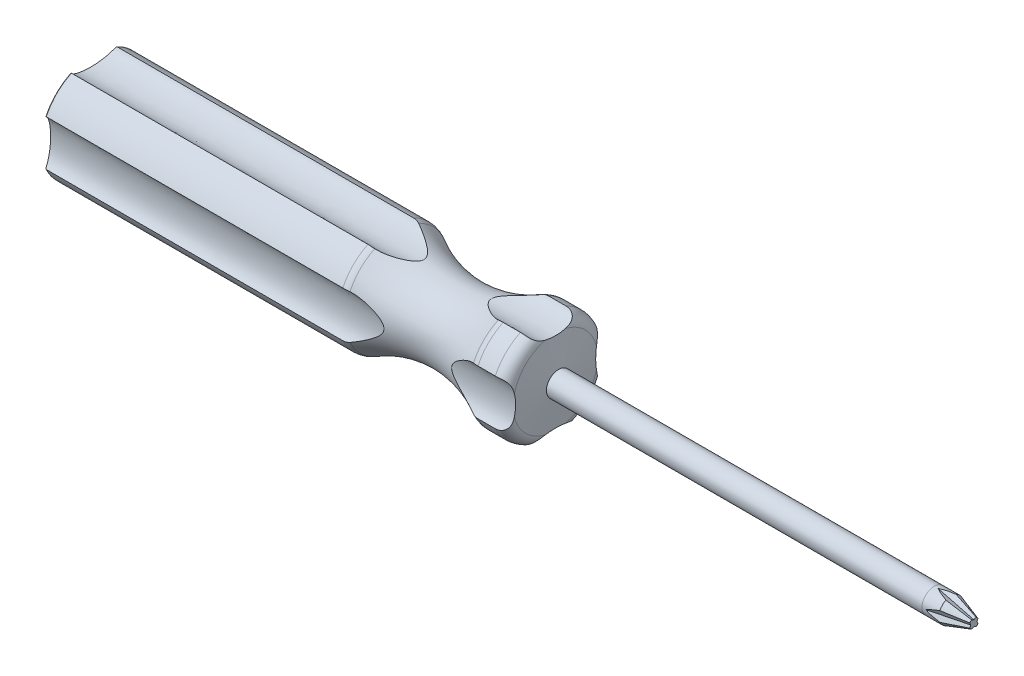
from build123d import *

# Parameters (mm, degrees)
SKETCH5_R                    = 0.53922581
CUT_EXTRUDE3_DEPTH           = 24
CUT_EXTRUDE1_DEPTH           = 3
CUT_EXTRUDE1_TAPER           = 23
CUT_EXTRUDE1_OTHER_WAY_DEPTH = 3
CUT_EXTRUDE1_OTHER_WAY_DRAFT = 23
CIRPATTERN1_COUNT            = 4
CIRPATTERN1_COPY_1_DEPTH     = 3
CIRPATTERN1_COPY_1_DRAFT     = 23
CIRPATTERN1_COPY_2_DEPTH     = 3
CIRPATTERN1_COPY_2_DRAFT     = 23
CIRPATTERN1_COPY_3_DEPTH     = 3
CIRPATTERN1_COPY_3_DRAFT     = 23
CIRPATTERN1_COPY_4_DEPTH     = 3
CIRPATTERN1_COPY_4_DRAFT     = 23
CIRPATTERN1_COPY_5_DEPTH     = 3
CIRPATTERN1_COPY_5_DRAFT     = 23
CIRPATTERN1_COPY_6_DEPTH     = 3
CIRPATTERN1_COPY_6_DRAFT     = 23
FILLET1_R                    = 4
SKETCH4_RX                   = 7.657958065
SKETCH4_RY                   = 3.350356654
CUT_EXTRUDE2_DEPTH           = 175
CIRPATTERN2_COUNT            = 4


with BuildPart() as part:
    # Sketch1 → Revolve1 (revolve)
    with BuildSketch(Plane.XY):
        Polygon((0, 0), (113.715967703, 0), (121.186821436, 0), (121.186821436, 1.520939997), (113.715967703, 4), (0, 4), (-66.928577077, 4), (-66.928577077, 0), align=None)
    revolve(axis=Axis((0, 0, 0), (-1, 0, 0)))

    # Sketch5 → Cut-Extrude3 (cut)
    with BuildSketch(Plane.ZY.offset(66.928577077)):
        with Locations((-3.5736542, -1.796940639)):
            Circle(SKETCH5_R)
        with Locations((-3.343023342, 2.196405002)):
            Circle(SKETCH5_R)
        with Locations((0.230630858, 3.993345641)):
            Circle(SKETCH5_R)
        with Locations((3.5736542, 1.796940639)):
            Circle(SKETCH5_R)
        with Locations((3.343023342, -2.196405002)):
            Circle(SKETCH5_R)
        with Locations((-0.230630858, -3.993345641)):
            Circle(SKETCH5_R)
    extrude(amount=-CUT_EXTRUDE3_DEPTH, mode=Mode.SUBTRACT)

    # Sketch2 → Cut-Extrude1 (cut)
    with BuildSketch(Plane.XY):
        Polygon((121.476129964, 0.92660861), (121.476129964, 4.464675581), (107.665254507, 4.464675581), align=None)
    cut_extrude1 = extrude(amount=-CUT_EXTRUDE1_DEPTH, taper=CUT_EXTRUDE1_TAPER, mode=Mode.SUBTRACT)


with BuildPart() as cut_extrude1_other_way_tool:
    # Sketch2 → Cut-Extrude1 other way (with draft: the straight prism first)
    with BuildSketch(Plane.XY):
        Polygon((121.476129964, 0.92660861), (121.476129964, 4.464675581), (107.665254507, 4.464675581), align=None)
    extrude(amount=CUT_EXTRUDE1_OTHER_WAY_DEPTH)
    # Cut-Extrude1 other way: the draft: its side faces are tilted about the plane it starts from
    cut_extrude1_other_way_sides = [cut_extrude1_other_way_tool.faces().sort_by_distance(p)[0] for p in [
        (121.476129964, 2.695642096, 1.5),
        (114.570692235, 4.464675581, 1.5),
        (114.570692235, 2.695642096, 1.5),
    ]]
    draft(cut_extrude1_other_way_sides, Plane.XY, CUT_EXTRUDE1_OTHER_WAY_DRAFT)


with BuildPart() as part_1:
    add(part.part)

    # Cut-Extrude1 other way: cut by cut_extrude1_other_way_tool
    add(cut_extrude1_other_way_tool.part, mode=Mode.SUBTRACT)

    # CirPattern1: Cut-Extrude1 ×4 about axis
    cirpattern1_axis = Axis((121.186821436, 0, 0), (1, 0, 0))
    for i in range(1, CIRPATTERN1_COUNT):
        add(cut_extrude1.rotate(cirpattern1_axis, i * 360 / CIRPATTERN1_COUNT), mode=Mode.SUBTRACT)


with BuildPart() as cirpattern1_copy_1_tool:
    # CirPattern1 copy 1 sketch → CirPattern1 copy 1 (with draft: the straight prism first)
    with BuildSketch(Plane.XZ):
        Polygon((121.476129964, 0.92660861), (121.476129964, 4.464675581), (107.665254507, 4.464675581), align=None)
    extrude(amount=CIRPATTERN1_COPY_1_DEPTH)
    # CirPattern1 copy 1: the draft: its side faces are tilted about the plane it starts from
    cirpattern1_copy_1_sides = [cirpattern1_copy_1_tool.faces().sort_by_distance(p)[0] for p in [
        (121.476129964, -1.5, 2.695642096),
        (114.570692235, -1.5, 4.464675581),
        (114.570692235, -1.5, 2.695642096),
    ]]
    draft(cirpattern1_copy_1_sides, Plane.XZ, CIRPATTERN1_COPY_1_DRAFT)


with BuildPart() as part_2:
    add(part_1.part)

    # CirPattern1 copy 1: cut by cirpattern1_copy_1_tool
    add(cirpattern1_copy_1_tool.part, mode=Mode.SUBTRACT)


with BuildPart() as cirpattern1_copy_2_tool:
    # CirPattern1 copy 2 sketch → CirPattern1 copy 2 (with draft: the straight prism first)
    with BuildSketch(Plane(origin=(0, 0, 0), x_dir=(1, 0, 0), z_dir=(0, 0, -1))):
        Polygon((121.476129964, 0.92660861), (121.476129964, 4.464675581), (107.665254507, 4.464675581), align=None)
    extrude(amount=CIRPATTERN1_COPY_2_DEPTH)
    # CirPattern1 copy 2: the draft: its side faces are tilted about the plane it starts from
    cirpattern1_copy_2_sides = [cirpattern1_copy_2_tool.faces().sort_by_distance(p)[0] for p in [
        (121.476129964, -2.695642096, -1.5),
        (114.570692235, -4.464675581, -1.5),
        (114.570692235, -2.695642096, -1.5),
    ]]
    draft(cirpattern1_copy_2_sides, Plane(origin=(0, 0, 0), x_dir=(1, 0, 0), z_dir=(0, 0, -1)), CIRPATTERN1_COPY_2_DRAFT)


with BuildPart() as part_3:
    add(part_2.part)

    # CirPattern1 copy 2: cut by cirpattern1_copy_2_tool
    add(cirpattern1_copy_2_tool.part, mode=Mode.SUBTRACT)


with BuildPart() as cirpattern1_copy_3_tool:
    # CirPattern1 copy 3 sketch → CirPattern1 copy 3 (with draft: the straight prism first)
    with BuildSketch(Plane(origin=(0, 0, 0), x_dir=(1, 0, 0), z_dir=(0, 1, 0))):
        Polygon((121.476129964, 0.92660861), (121.476129964, 4.464675581), (107.665254507, 4.464675581), align=None)
    extrude(amount=CIRPATTERN1_COPY_3_DEPTH)
    # CirPattern1 copy 3: the draft: its side faces are tilted about the plane it starts from
    cirpattern1_copy_3_sides = [cirpattern1_copy_3_tool.faces().sort_by_distance(p)[0] for p in [
        (121.476129964, 1.5, -2.695642096),
        (114.570692235, 1.5, -4.464675581),
        (114.570692235, 1.5, -2.695642096),
    ]]
    draft(cirpattern1_copy_3_sides, Plane(origin=(0, 0, 0), x_dir=(1, 0, 0), z_dir=(0, 1, 0)), CIRPATTERN1_COPY_3_DRAFT)


with BuildPart() as part_4:
    add(part_3.part)

    # CirPattern1 copy 3: cut by cirpattern1_copy_3_tool
    add(cirpattern1_copy_3_tool.part, mode=Mode.SUBTRACT)


with BuildPart() as cirpattern1_copy_4_tool:
    # CirPattern1 copy 4 sketch → CirPattern1 copy 4 (with draft: the straight prism first)
    with BuildSketch(Plane.XZ):
        Polygon((121.476129964, 0.92660861), (121.476129964, 4.464675581), (107.665254507, 4.464675581), align=None)
    extrude(amount=CIRPATTERN1_COPY_4_DEPTH)
    # CirPattern1 copy 4: the draft: its side faces are tilted about the plane it starts from
    cirpattern1_copy_4_sides = [cirpattern1_copy_4_tool.faces().sort_by_distance(p)[0] for p in [
        (121.476129964, -1.5, 2.695642096),
        (114.570692235, -1.5, 4.464675581),
        (114.570692235, -1.5, 2.695642096),
    ]]
    draft(cirpattern1_copy_4_sides, Plane.XZ, CIRPATTERN1_COPY_4_DRAFT)


with BuildPart() as part_5:
    add(part_4.part)

    # CirPattern1 copy 4: cut by cirpattern1_copy_4_tool
    add(cirpattern1_copy_4_tool.part, mode=Mode.SUBTRACT)


with BuildPart() as cirpattern1_copy_5_tool:
    # CirPattern1 copy 5 sketch → CirPattern1 copy 5 (with draft: the straight prism first)
    with BuildSketch(Plane(origin=(0, 0, 0), x_dir=(1, 0, 0), z_dir=(0, 0, -1))):
        Polygon((121.476129964, 0.92660861), (121.476129964, 4.464675581), (107.665254507, 4.464675581), align=None)
    extrude(amount=CIRPATTERN1_COPY_5_DEPTH)
    # CirPattern1 copy 5: the draft: its side faces are tilted about the plane it starts from
    cirpattern1_copy_5_sides = [cirpattern1_copy_5_tool.faces().sort_by_distance(p)[0] for p in [
        (121.476129964, -2.695642096, -1.5),
        (114.570692235, -4.464675581, -1.5),
        (114.570692235, -2.695642096, -1.5),
    ]]
    draft(cirpattern1_copy_5_sides, Plane(origin=(0, 0, 0), x_dir=(1, 0, 0), z_dir=(0, 0, -1)), CIRPATTERN1_COPY_5_DRAFT)


with BuildPart() as part_6:
    add(part_5.part)

    # CirPattern1 copy 5: cut by cirpattern1_copy_5_tool
    add(cirpattern1_copy_5_tool.part, mode=Mode.SUBTRACT)


with BuildPart() as cirpattern1_copy_6_tool:
    # CirPattern1 copy 6 sketch → CirPattern1 copy 6 (with draft: the straight prism first)
    with BuildSketch(Plane(origin=(0, 0, 0), x_dir=(1, 0, 0), z_dir=(0, 1, 0))):
        Polygon((121.476129964, 0.92660861), (121.476129964, 4.464675581), (107.665254507, 4.464675581), align=None)
    extrude(amount=CIRPATTERN1_COPY_6_DEPTH)
    # CirPattern1 copy 6: the draft: its side faces are tilted about the plane it starts from
    cirpattern1_copy_6_sides = [cirpattern1_copy_6_tool.faces().sort_by_distance(p)[0] for p in [
        (121.476129964, 1.5, -2.695642096),
        (114.570692235, 1.5, -4.464675581),
        (114.570692235, 1.5, -2.695642096),
    ]]
    draft(cirpattern1_copy_6_sides, Plane(origin=(0, 0, 0), x_dir=(1, 0, 0), z_dir=(0, 1, 0)), CIRPATTERN1_COPY_6_DRAFT)


with BuildPart() as part_7:
    add(part_6.part)

    # CirPattern1 copy 6: cut by cirpattern1_copy_6_tool
    add(cirpattern1_copy_6_tool.part, mode=Mode.SUBTRACT)


with BuildPart() as body_2:
    # Sketch3 → Revolve2 (revolve)
    with BuildSketch(Plane.XY):
        with BuildLine():
            Line((-14.704877313, 4), (-66.928577077, 4))
            Line((-66.928577077, 4), (-66.928577077, 0))
            Line((-66.928577077, 0), (-168.510801794, 0))
            add(Edge.make_bspline(
                [(-166.661414618, 17.403092786), (-168.510801794, 17.403092786), (-168.510801794, 0)],
                knots=[0, 0, 0, 1.570796327, 1.570796327, 1.570796327], degree=2, weights=[1, 0.707106781, 1]))
            Line((-166.661414618, 17.403092786), (-68.590046709, 17.403092786))
            add(Edge.make_bspline(
                [(-68.590046709, 17.403092786), (-62.879268217, 14.10053517), (-49.03627588, 9.486905272), (-34.823354616, 12.789462889), (-26.414275334, 17.403092786)],
                knots=[0.086154093, 0.086154093, 0.086154093, 0.086154093, 0.431459191, 0.913845907, 0.913845907, 0.913845907, 0.913845907], degree=3))
            Line((-26.414275334, 17.403092786), (-16.142141955, 17.403092786))
            Line((-16.142141955, 17.403092786), (-14.704877313, 4))
        make_face()
    revolve(axis=Axis((-66.928577077, 0, 0), (-1, 0, 0)))

    # Fillet1
    fillet1_edges = [body_2.edges().sort_by_distance(p)[0] for p in [
        (-16.142141955, -17.403092786, 0),
        (-26.414275334, -17.403092786, 0),
        (-68.590046709, -17.403092786, 0),
    ]]
    fillet(fillet1_edges, radius=FILLET1_R)

    # Sketch4 → Cut-Extrude2 (cut)
    with BuildSketch(Plane(origin=(0, 0, 0), x_dir=(0, 0, -1), z_dir=(1, 0, 0))):
        with Locations((0, 16.452644281)):
            Ellipse(SKETCH4_RX, SKETCH4_RY)
    cut_extrude2 = extrude(amount=-CUT_EXTRUDE2_DEPTH, mode=Mode.SUBTRACT)

    # CirPattern2: Cut-Extrude2 ×4 about axis
    cirpattern2_axis = Axis((-14.704877313, 0, 0), (1, 0, 0))
    for i in range(1, CIRPATTERN2_COUNT):
        add(cut_extrude2.rotate(cirpattern2_axis, i * 360 / CIRPATTERN2_COUNT), mode=Mode.SUBTRACT)


solid = Compound([part_7.part, body_2.part])
